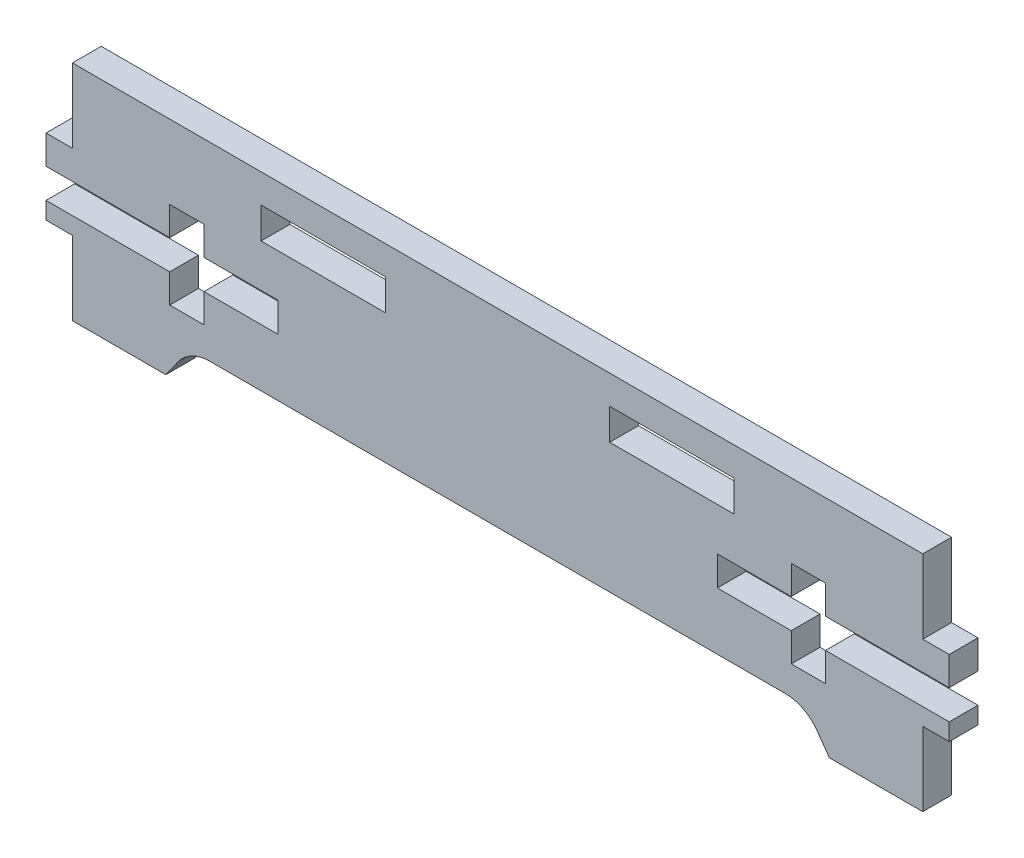
from build123d import *

# Parameters (mm, degrees)
BOSS_EXTRUDE1_DEPTH = 3.7
FILLET1_R           = 5
SKETCH3_W           = 16
SKETCH3_H           = 4
CUT_EXTRUDE1_DEPTH  = 62.374947331


with BuildPart() as part:
    # Sketch2 → Boss-Extrude1 (new body)
    with BuildSketch(Plane.XY):
        Polygon((-54.64, 19.610011726), (54.64, 19.610011726), (54.64, 10.110011726), (58.04, 10.110011726), (58.04, 6.410011726), (42.14, 6.410011726), (42.14, 10.110011726), (37.74, 10.110011726), (37.74, 6.410011726), (28.24, 6.410011726), (28.24, 2.610011726), (37.74, 2.610011726), (37.74, -1.089988274), (42.14, -1.089988274), (42.14, 2.610011726), (58.04, 2.610011726), (58.04, 0.410011726), (54.64, 0.410011726), (54.64, -9.089988274), (42.64, -9.089988274), (39.572296355, -4.769343347), (-39.572296355, -4.769343347), (-42.64, -9.089988274), (-54.64, -9.089988274), (-54.64, 0.410011726), (-58.04, 0.410011726), (-58.04, 2.610011726), (-42.14, 2.610011726), (-42.14, -1.089988274), (-37.74, -1.089988274), (-37.74, 2.610011726), (-28.24, 2.610011726), (-28.24, 6.410011726), (-37.74, 6.410011726), (-37.74, 10.110011726), (-42.14, 10.110011726), (-42.14, 6.410011726), (-58.04, 6.410011726), (-58.04, 10.110011726), (-54.64, 10.110011726), align=None)
    extrude(amount=BOSS_EXTRUDE1_DEPTH)

    # Fillet1
    fillet1_edges = [part.edges().sort_by_distance(p)[0] for p in [
        (39.572296355, -4.769343347, 1.85),
        (-39.572296355, -4.769343347, 1.85),
    ]]
    fillet(fillet1_edges, radius=FILLET1_R)

    # Sketch3 → Cut-Extrude1 (cut, through all)
    with BuildSketch(Plane.XY.offset(3.7)):
        with Locations((22.4, 13.910011726)):
            Rectangle(SKETCH3_W, SKETCH3_H)
        with Locations((-22.4, 13.910011726)):
            Rectangle(SKETCH3_W, SKETCH3_H)
    extrude(amount=-CUT_EXTRUDE1_DEPTH, mode=Mode.SUBTRACT)


solid = part.part
